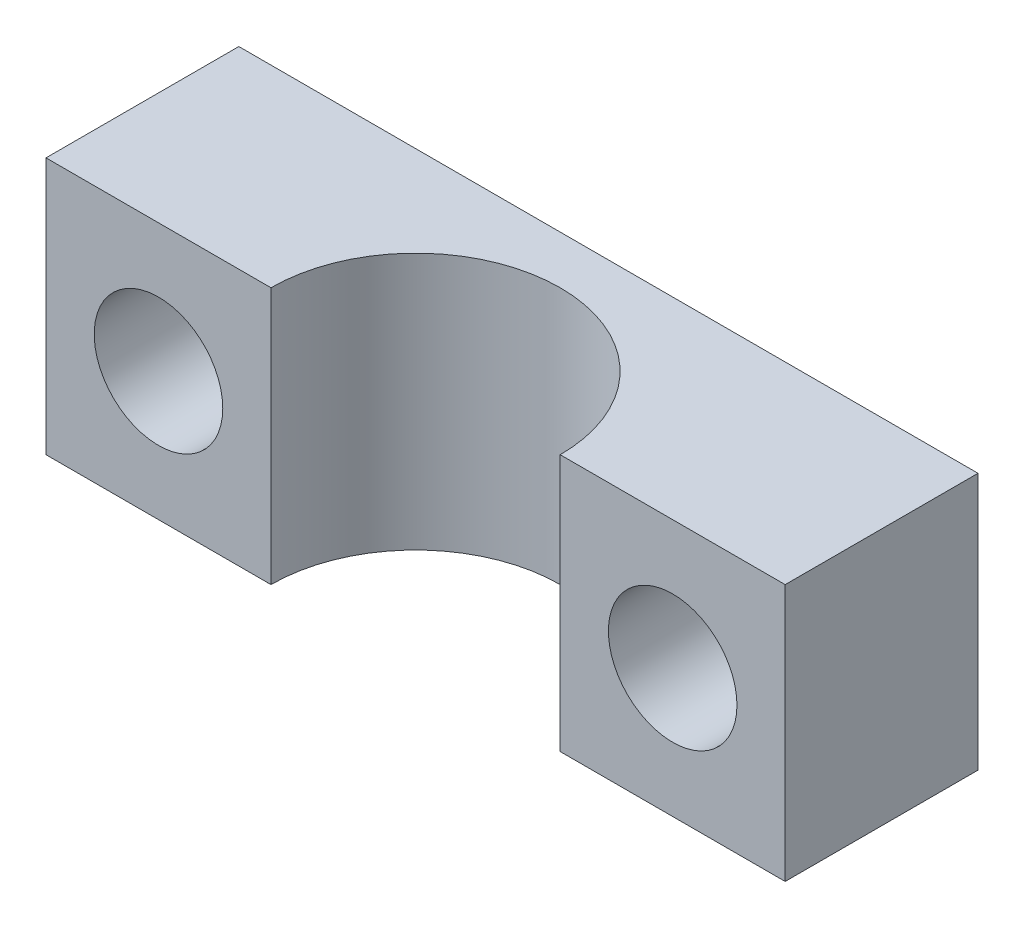
from build123d import *

# Parameters (mm, degrees)
SKETCH2_W           = 115
SKETCH2_H           = 40
BOSS_EXTRUDE1_DEPTH = 60
CUT_EXTRUDE1_DEPTH  = 60
SKETCH4_R           = 10
CUT_EXTRUDE2_DEPTH  = 60


with BuildPart() as part:
    # Sketch2 → Boss-Extrude1 (new body)
    with BuildSketch(Plane.XY):
        with Locations((-2.12962963, 23.505291005)):
            Rectangle(SKETCH2_W, SKETCH2_H)
    extrude(amount=BOSS_EXTRUDE1_DEPTH)

    # Sketch3 → Cut-Extrude1 (cut)
    with BuildSketch(Plane(origin=(0, 43.505291005, 0), x_dir=(1, 0, 0), z_dir=(0, 1, 0))):
        with BuildLine():
            Line((-59.62962963, -30), (-24.62962963, -30))
            ThreePointArc((-24.62962963, -30), (-2.12962963, -7.5), (20.37037037, -30))
            Line((20.37037037, -30), (55.37037037, -30))
            Line((55.37037037, -30), (55.37037037, -60))
            Line((55.37037037, -60), (-59.62962963, -60))
            Line((-59.62962963, -60), (-59.62962963, -30))
        make_face()
    extrude(amount=-CUT_EXTRUDE1_DEPTH, mode=Mode.SUBTRACT)

    # Sketch4 → Cut-Extrude2 (cut)
    with BuildSketch(Plane.XY.offset(30)):
        with Locations((-42.12962963, 23.505291005)):
            Circle(SKETCH4_R)
        with Locations((37.87037037, 23.505291005)):
            Circle(SKETCH4_R)
    extrude(amount=-CUT_EXTRUDE2_DEPTH, mode=Mode.SUBTRACT)


solid = part.part
